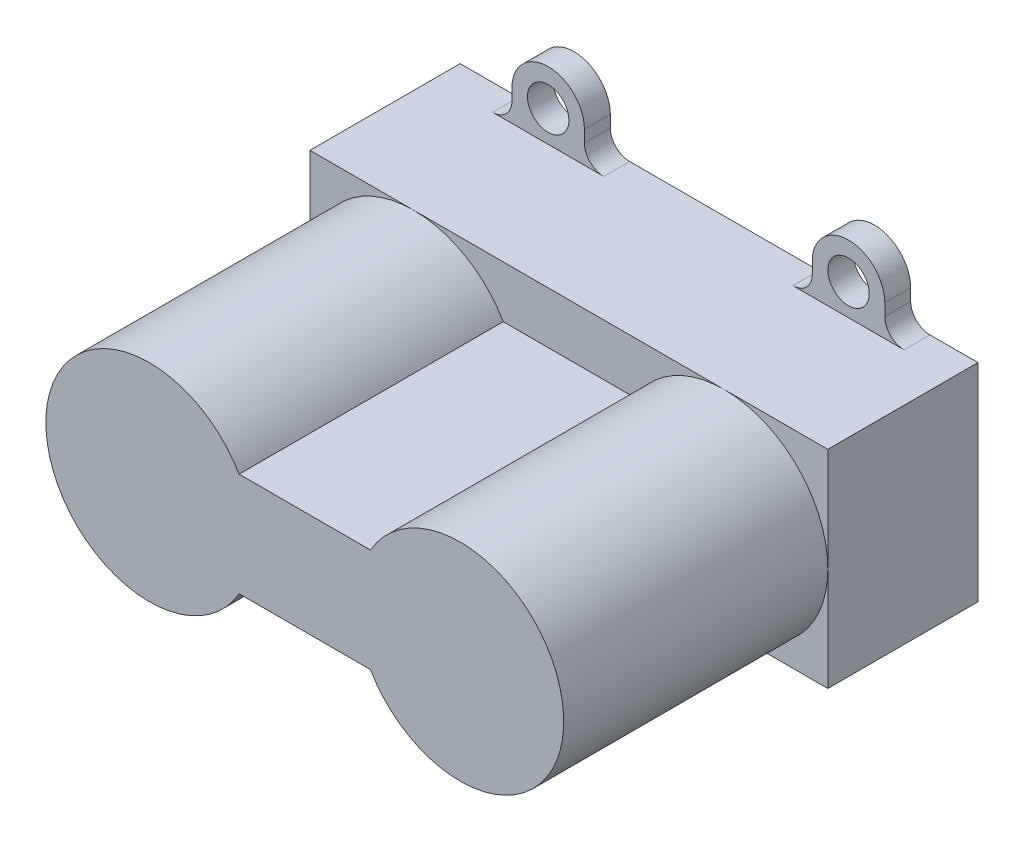
from build123d import *

# Parameters (mm, degrees)
ESQUISSE1_R             = 2
BOSS_EXTRU_1_DEPTH      = 14.5
ESQUISSE3_W             = 12
ESQUISSE3_H             = 6.5
ENL_V_MAT_EXTRU_1_DEPTH = 55.612269684
BOSS_EXTRU_2_DEPTH      = 25.5


with BuildPart() as part:
    # Esquisse1 → Boss.-Extru.1 (new body)
    with BuildSketch(Plane.XY):
        with BuildLine():
            Line((-25, -10), (-19.364230348, -10))
            ThreePointArc((-19.364230348, -10), (-18.046020427, -10.546020427), (-17.5, -11.864230348))
            Line((-17.5, -11.864230348), (-17.5, -13))
            ThreePointArc((-17.5, -13), (-14, -16.5), (-10.5, -13))
            Line((-10.5, -13), (-10.5, -11.864230348))
            ThreePointArc((-10.5, -11.864230348), (-9.953979573, -10.546020427), (-8.635769652, -10))
            Line((-8.635769652, -10), (9.635769652, -10))
            ThreePointArc((9.635769652, -10), (10.953979573, -10.546020427), (11.5, -11.864230348))
            Line((11.5, -11.864230348), (11.5, -13))
            ThreePointArc((11.5, -13), (15, -16.5), (18.5, -13))
            Line((18.5, -13), (18.5, -11.864230348))
            ThreePointArc((18.5, -11.864230348), (19.046020427, -10.546020427), (20.364230348, -10))
            Line((20.364230348, -10), (25, -10))
            Line((25, -10), (25, 10))
            Line((25, 10), (20.364230348, 10))
            ThreePointArc((20.364230348, 10), (19.046020427, 10.546020427), (18.5, 11.864230348))
            Line((18.5, 11.864230348), (18.5, 13))
            ThreePointArc((18.5, 13), (15, 16.5), (11.5, 13))
            Line((11.5, 13), (11.5, 11.864230348))
            ThreePointArc((11.5, 11.864230348), (10.953979573, 10.546020427), (9.635769652, 10))
            Line((9.635769652, 10), (-8.635769652, 10))
            ThreePointArc((-8.635769652, 10), (-9.953979573, 10.546020427), (-10.5, 11.864230348))
            Line((-10.5, 11.864230348), (-10.5, 13))
            ThreePointArc((-10.5, 13), (-14, 16.5), (-17.5, 13))
            Line((-17.5, 13), (-17.5, 11.864230348))
            ThreePointArc((-17.5, 11.864230348), (-18.046020427, 10.546020427), (-19.364230348, 10))
            Line((-19.364230348, 10), (-25, 10))
            Line((-25, 10), (-25, -10))
        make_face()
        with Locations(Location((-14, 13, 0), (0, 0, 180))):
            Circle(ESQUISSE1_R, mode=Mode.SUBTRACT)
        with Locations(Location((15, 13, 0), (0, 0, 180))):
            Circle(ESQUISSE1_R, mode=Mode.SUBTRACT)
        with Locations(Location((-14, -13, 0), (0, 0, 180))):
            Circle(ESQUISSE1_R, mode=Mode.SUBTRACT)
        with Locations(Location((15, -13, 0), (0, 0, 180))):
            Circle(ESQUISSE1_R, mode=Mode.SUBTRACT)
    extrude(amount=BOSS_EXTRU_1_DEPTH)

    # Esquisse3 → Enlèv. mat.-Extru.1 (cut, through all)
    with BuildSketch(Plane(origin=(25, 0, 0), x_dir=(0, 0, -1), z_dir=(1, 0, 0))):
        with Locations((-8.5, 13.25)):
            Rectangle(ESQUISSE3_W, ESQUISSE3_H)
        with Locations((-8.5, -13.25)):
            Rectangle(ESQUISSE3_W, ESQUISSE3_H)
    extrude(amount=-ENL_V_MAT_EXTRU_1_DEPTH, mode=Mode.SUBTRACT)

    # Esquisse4 → Boss.-Extru.2 (add)
    with BuildSketch(Plane.XY.offset(14.5)):
        with BuildLine():
            Line((-6.339745962, -5), (6.339745962, -5))
            ThreePointArc((6.339745962, -5), (25, 0), (6.339745962, 5))
            Line((6.339745962, 5), (-6.339745962, 5))
            ThreePointArc((-6.339745962, 5), (-25, 0), (-6.339745962, -5))
        make_face()
    extrude(amount=BOSS_EXTRU_2_DEPTH)


solid = part.part
